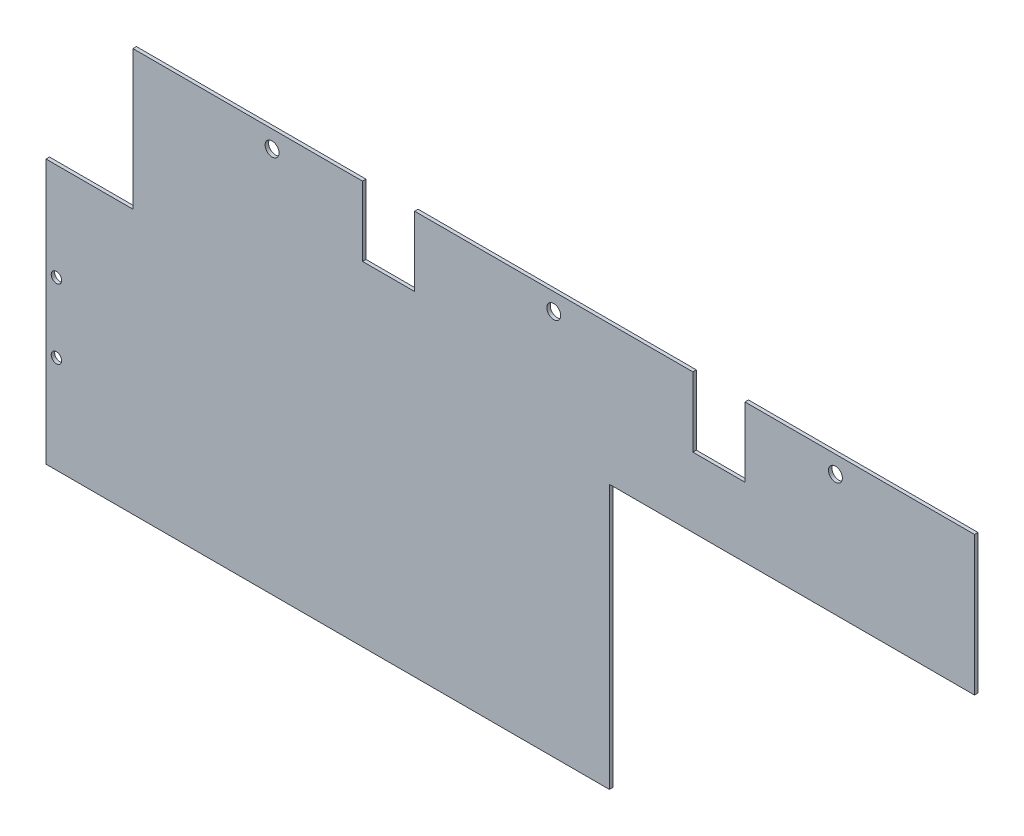
from build123d import *

# Parameters (mm, degrees)
SKETCH_1_R          = 1.5
EXTRUDE_1_DEPTH     = 1
SKETCH_2_R          = 2
SKETCH_2_W          = 15
SKETCH_2_H          = 20
CUT_EXTRUDE_1_DEPTH = 315.198981539
SKETCH_3_W          = 130
SKETCH_3_H          = 76
CUT_EXTRUDE_2_DEPTH = 315.198981539


with BuildPart() as part:
    # 草图1 → 凸台-拉伸1 (new body)
    with BuildSketch(Plane.XY):
        Polygon((0, 0), (0, 76), (25, 76), (25, 116), (267, 116), (267, 76), (292, 76), (292, 0), align=None)
        with Locations((3, 48)):
            Circle(SKETCH_1_R, mode=Mode.SUBTRACT)
        with Locations((3, 28)):
            Circle(SKETCH_1_R, mode=Mode.SUBTRACT)
        with Locations(Location((289, 28, 0), (0, 0, 180))):
            Circle(SKETCH_1_R, mode=Mode.SUBTRACT)
        with Locations(Location((289, 48, 0), (0, 0, 180))):
            Circle(SKETCH_1_R, mode=Mode.SUBTRACT)
    extrude(amount=EXTRUDE_1_DEPTH)

    # 草图2 → 切除-拉伸1 (cut, through all)
    with BuildSketch(Plane.XY.offset(1)):
        with Locations((65, 111)):
            Circle(SKETCH_2_R)
        with Locations(Location((227, 111, 0), (0, 0, 180))):
            Circle(SKETCH_2_R)
        with Locations((146, 111)):
            Circle(SKETCH_2_R)
        with Locations((193.5, 106)):
            Rectangle(SKETCH_2_W, SKETCH_2_H)
        with Locations((98.5, 106)):
            Rectangle(SKETCH_2_W, SKETCH_2_H)
    extrude(amount=-CUT_EXTRUDE_1_DEPTH, mode=Mode.SUBTRACT)

    # 草图3 → 切除-拉伸2 (cut, through all)
    with BuildSketch(Plane.XY.offset(1)):
        with Locations((227, 38)):
            Rectangle(SKETCH_3_W, SKETCH_3_H)
    extrude(amount=-CUT_EXTRUDE_2_DEPTH, mode=Mode.SUBTRACT)


solid = part.part
